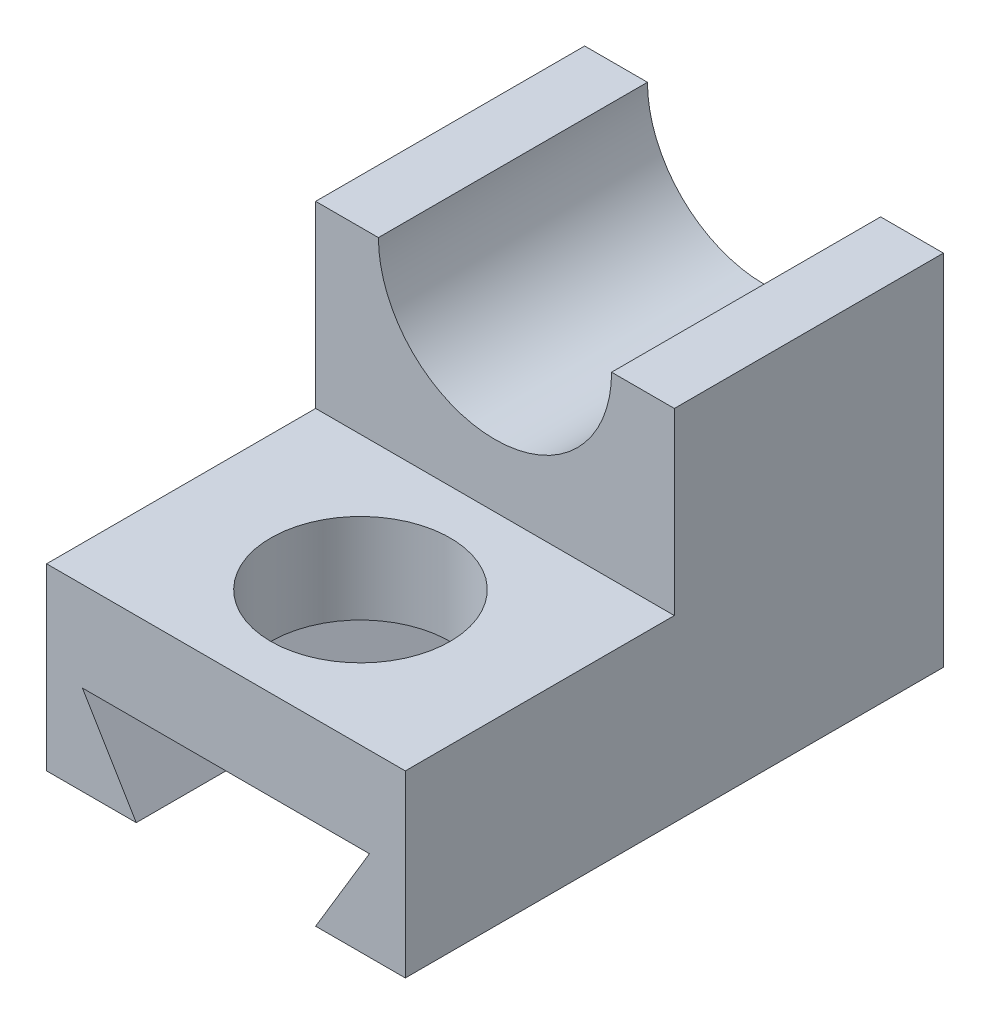
from build123d import *

# Parameters (mm, degrees)
EXTRUDE_1_DEPTH     = 20
CUT_EXTRUDE_2_DEPTH = 75.833147735
SKETCH_3_R          = 10
CUT_EXTRUDE_3_DEPTH = 67.332495807
CUT_EXTRUDE_4_DEPTH = 54.851648071


with BuildPart() as part:
    # 草图1 → 凸台-拉伸1 (new, symmetric)
    with BuildSketch(Plane(origin=(0, 0, 0), x_dir=(0, 0, -1), z_dir=(1, 0, 0))):
        Polygon((0, 0), (0, 20), (30, 20), (30, 40), (60, 40), (60, 0), align=None)
    extrude(amount=EXTRUDE_1_DEPTH, both=True)

    # 草图2 → 切除-拉伸2 (cut, through all)
    with BuildSketch(Plane.XY):
        Polygon((10, 0), (16, 10), (-16, 10), (-10, 0), align=None)
    extrude(amount=-CUT_EXTRUDE_2_DEPTH, mode=Mode.SUBTRACT)

    # 草图3 → 切除-拉伸3 (cut, through all)
    with BuildSketch(Plane(origin=(0, 20, 0), x_dir=(1, 0, 0), z_dir=(0, 1, 0))):
        with Locations(Location((0, 15, 0), (0, 0, 270))):
            Circle(SKETCH_3_R)
    extrude(amount=-CUT_EXTRUDE_3_DEPTH, mode=Mode.SUBTRACT)

    # 草图4 → 切除-拉伸4 (cut, through all)
    with BuildSketch(Plane.XY.offset(-30)):
        with BuildLine():
            Line((-13, 40), (13, 40))
            ThreePointArc((13, 40), (0, 27), (-13, 40))
        make_face()
    extrude(amount=-CUT_EXTRUDE_4_DEPTH, mode=Mode.SUBTRACT)


solid = part.part
